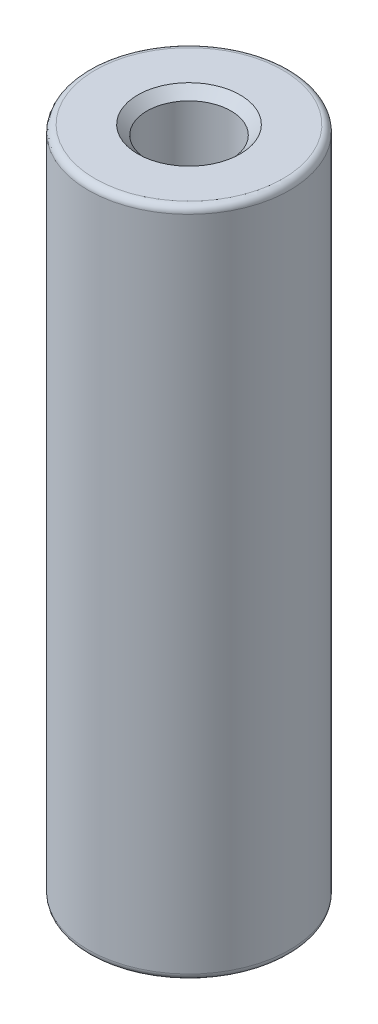
from build123d import *

# Parameters (mm, degrees)
SKETCH1_R           = 3
BOSS_EXTRUDE1_DEPTH = 20
FILLET1_R           = 0.2


with BuildPart() as part:
    # Sketch1 → Boss-Extrude1 (new body)
    with BuildSketch(Plane(origin=(0, 0, 0), x_dir=(1, 0, 0), z_dir=(0, 1, 0))):
        with Locations(Location((0, 0, 0), (0, 0, 270))):
            Circle(SKETCH1_R)
    extrude(amount=BOSS_EXTRUDE1_DEPTH)

    # Fillet1
    fillet1_edges = [part.edges().sort_by_distance(p)[0] for p in [
        (0, 0, -3),
        (0, 20, -3),
    ]]
    fillet(fillet1_edges, radius=FILLET1_R)

    # Sketch3 → M3x0.5 Tapped Hole1 (revolve, cut)
    with BuildSketch(Plane(origin=(0, 20, 0), x_dir=(0, 0, 1), z_dir=(1, 0, 0))):
        Polygon((0, 0), (0, 20), (1.525, 20), (1.25, 19.725), (1.25, 0.275), (1.525, 0), align=None)
    revolve(axis=Axis((0, 26.35, 0), (0, -1, 0)), mode=Mode.SUBTRACT)


solid = part.part
